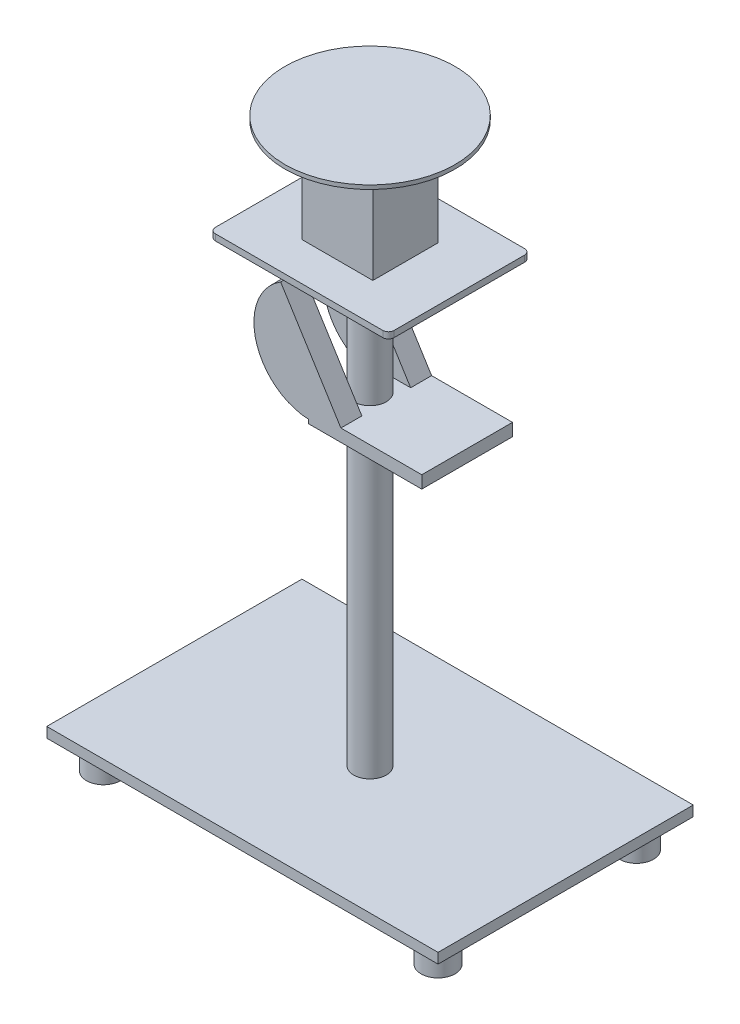
from build123d import *

# Parameters (mm, degrees)
SKETCH2_R           = 150.026309836
BOSS_EXTRUDE1_DEPTH = 7
SKETCH3_W           = 125
SKETCH3_H           = 115
BOSS_EXTRUDE2_DEPTH = 185
SKETCH4_W           = 315
SKETCH4_H           = 250
BOSS_EXTRUDE3_DEPTH = 11
SKETCH5_R           = 28.662420382
BOSS_EXTRUDE4_DEPTH = 790
SKETCH6_W           = 690
SKETCH6_H           = 450
BOSS_EXTRUDE5_DEPTH = 18
SKETCH7_R           = 29.971446918
BOSS_EXTRUDE6_DEPTH = 50
BOSS_EXTRUDE7_DEPTH = 22
BOSS_EXTRUDE8_DEPTH = 37
FILLET1_R           = 10


with BuildPart() as part:
    # Sketch2 → Boss-Extrude1 (new body)
    with BuildSketch(Plane(origin=(0, 0, 0), x_dir=(1, 0, 0), z_dir=(0, 1, 0))):
        with Locations(Location((0, 0, 0), (0, 0, 270))):
            Circle(SKETCH2_R)
    extrude(amount=-BOSS_EXTRUDE1_DEPTH)

    # Sketch3 → Boss-Extrude2 (add)
    with BuildSketch(Plane.XZ.offset(7)):
        Rectangle(SKETCH3_W, SKETCH3_H)
    extrude(amount=BOSS_EXTRUDE2_DEPTH)

    # Sketch4 → Boss-Extrude3 (add)
    with BuildSketch(Plane.XZ.offset(192)):
        Rectangle(SKETCH4_W, SKETCH4_H)
    extrude(amount=BOSS_EXTRUDE3_DEPTH)

    # Sketch5 → Boss-Extrude4 (add)
    with BuildSketch(Plane.XZ.offset(203)):
        with Locations(Location((0, 0, 0), (0, 0, 90))):
            Circle(SKETCH5_R)
    extrude(amount=BOSS_EXTRUDE4_DEPTH)

    # Sketch6 → Boss-Extrude5 (add)
    with BuildSketch(Plane.XZ.offset(993)):
        Rectangle(SKETCH6_W, SKETCH6_H)
    extrude(amount=BOSS_EXTRUDE5_DEPTH)

    # Sketch7 → Boss-Extrude6 (add)
    with BuildSketch(Plane.XZ.offset(1011)):
        with Locations(Location((-295, 175, 0), (0, 0, 270))):
            Circle(SKETCH7_R)
        with Locations(Location((-295, -175, 0), (0, 0, 270))):
            Circle(SKETCH7_R)
        with Locations(Location((295, 175, 0), (0, 0, 270))):
            Circle(SKETCH7_R)
        with Locations(Location((295, -175, 0), (0, 0, 270))):
            Circle(SKETCH7_R)
    extrude(amount=BOSS_EXTRUDE6_DEPTH)

    # Sketch11 → Boss-Extrude7 (add)
    with BuildSketch(Plane(origin=(0, -423, 0), x_dir=(-1, 0, 0), z_dir=(0, -1, 0))):
        Polygon((28.709807748, 0), (28.709807748, -80), (-171.290192252, -80), (-171.290192252, 80), (28.709807748, 80), align=None)
    extrude(amount=BOSS_EXTRUDE7_DEPTH)

    # Sketch12 → Boss-Extrude8 (add)
    with BuildSketch(Plane.XY.offset(80)):
        with BuildLine():
            Line((-77.568003655, -253), (28.662420382, -423))
            ThreePointArc((28.662420382, -423), (-109.452791637, -391.115212019), (-77.568003655, -253))
        make_face()
    boss_extrude8 = extrude(amount=-BOSS_EXTRUDE8_DEPTH)

    # Mirror1: Boss-Extrude8 across plane
    add(boss_extrude8.mirror(Plane.XY))

    # Fillet1
    fillet1_edges = [part.edges().sort_by_distance(p)[0] for p in [
        (-157.5, -197.5, 125),
        (-157.5, -197.5, -125),
        (157.5, -197.5, -125),
        (157.5, -197.5, 125),
    ]]
    fillet(fillet1_edges, radius=FILLET1_R)


solid = part.part
